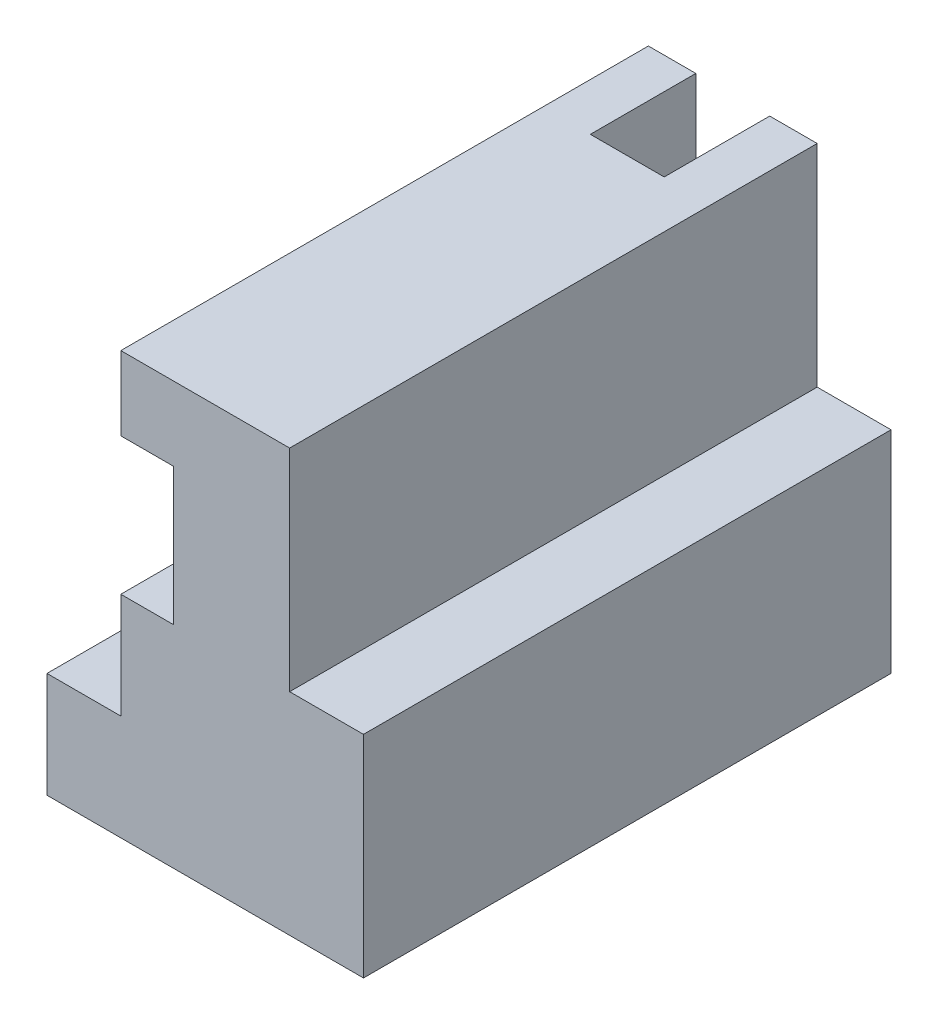
from build123d import *

# Parameters (mm, degrees)
EXTRUDE_2_DEPTH     = 50
SKETCH_2_W          = 7
SKETCH_2_H          = 35
SKETCH_2_H_2        = 5
SKETCH_2_W_2        = 6.5
CUT_EXTRUDE_1_DEPTH = 10
SKETCH_3_W          = 8
SKETCH_3_H          = 13
CUT_EXTRUDE_2_DEPTH = 5


with BuildPart() as part:
    # Эскиз1 → Бобышка-Вытянуть2 (new body)
    with BuildSketch(Plane.XY):
        Polygon((8, 20), (-8, 20), (-8, -10), (-15, -10), (-15, -20), (15, -20), (15, 0), (8, 0), (8, 10), align=None)
    extrude(amount=EXTRUDE_2_DEPTH)

    # Эскиз2 → Вырез-Вытянуть1 (cut)
    with BuildSketch(Plane(origin=(0, 0, 0), x_dir=(-1, 0, 0), z_dir=(0, 0, -1))):
        with Locations((0, 2.5)):
            Rectangle(SKETCH_2_W, SKETCH_2_H)
        with Locations((0, -17.5)):
            Rectangle(SKETCH_2_W, SKETCH_2_H_2)
        with Locations((6.75, -17.5)):
            Rectangle(SKETCH_2_W_2, SKETCH_2_H_2)
        with Locations((-6.75, -17.5)):
            Rectangle(SKETCH_2_W_2, SKETCH_2_H_2)
    extrude(amount=-CUT_EXTRUDE_1_DEPTH, mode=Mode.SUBTRACT)

    # Эскиз3 → Вырез-Вытянуть2 (cut)
    with BuildSketch(Plane.ZY.offset(8)):
        with Locations((46, 6.5)):
            Rectangle(SKETCH_3_W, SKETCH_3_H)
    extrude(amount=-CUT_EXTRUDE_2_DEPTH, mode=Mode.SUBTRACT)


solid = part.part
